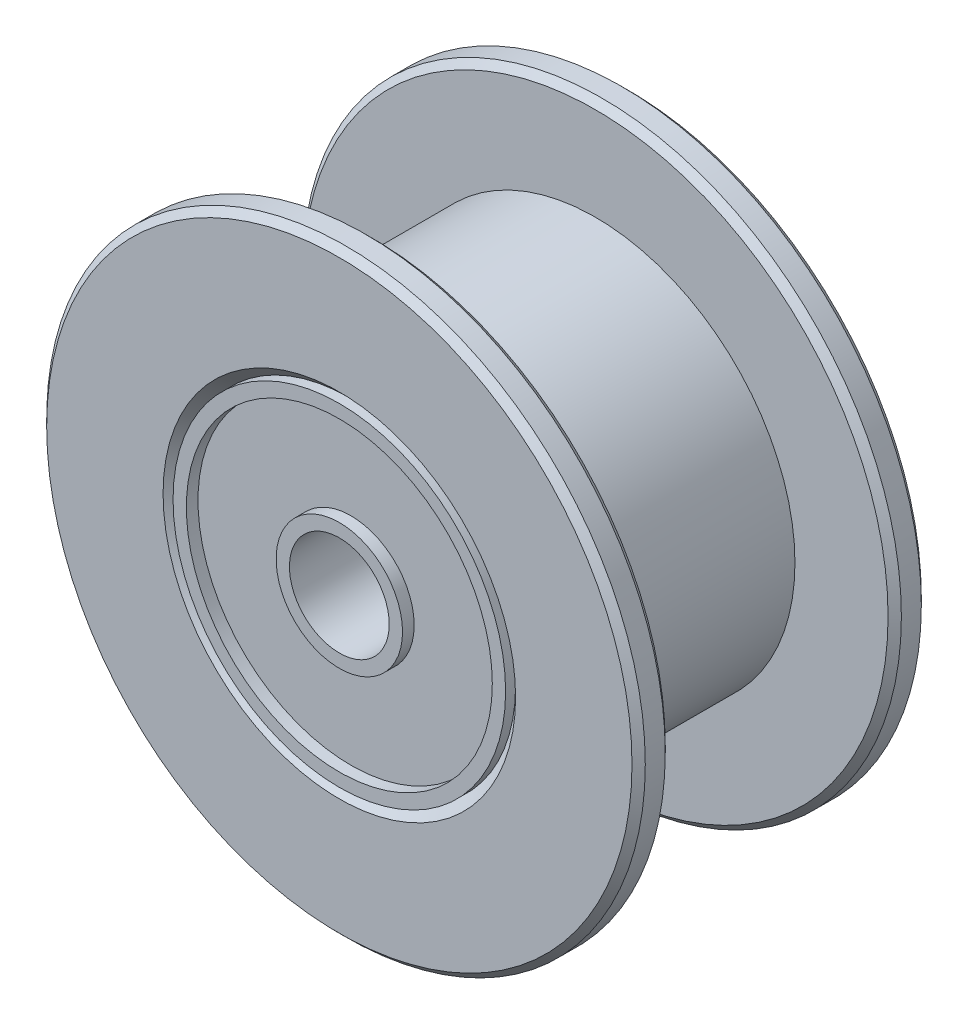
from build123d import *


with BuildPart() as part:
    # Эскиз1 → Повернуть1 (revolve)
    with BuildSketch(Plane(origin=(0, 0, 0), x_dir=(1, 0, 0), z_dir=(0, 1, 0))):
        Polygon((4.6, 4.35), (4.6, 4), (1.9, 4), (1.9, 4.35), (1.5, 4.35), (1.5, -4.35), (1.9, -4.35), (1.9, -4), (4.6, -4), (4.6, -4.35), (5, -4.35), (5, -4.05), (5.3, -4.35), (8.8, -4.35), (9, -4.15), (9, -3.55), (8.8, -3.35), (6, -3.35), (6, 3.35), (8.8, 3.35), (9, 3.55), (9, 4.15), (8.8, 4.35), (5.3, 4.35), (5, 4.05), (5, 4.35), align=None)
    revolve(axis=Axis((0, 0, -4.35), (0, 0, 1)))


solid = part.part
